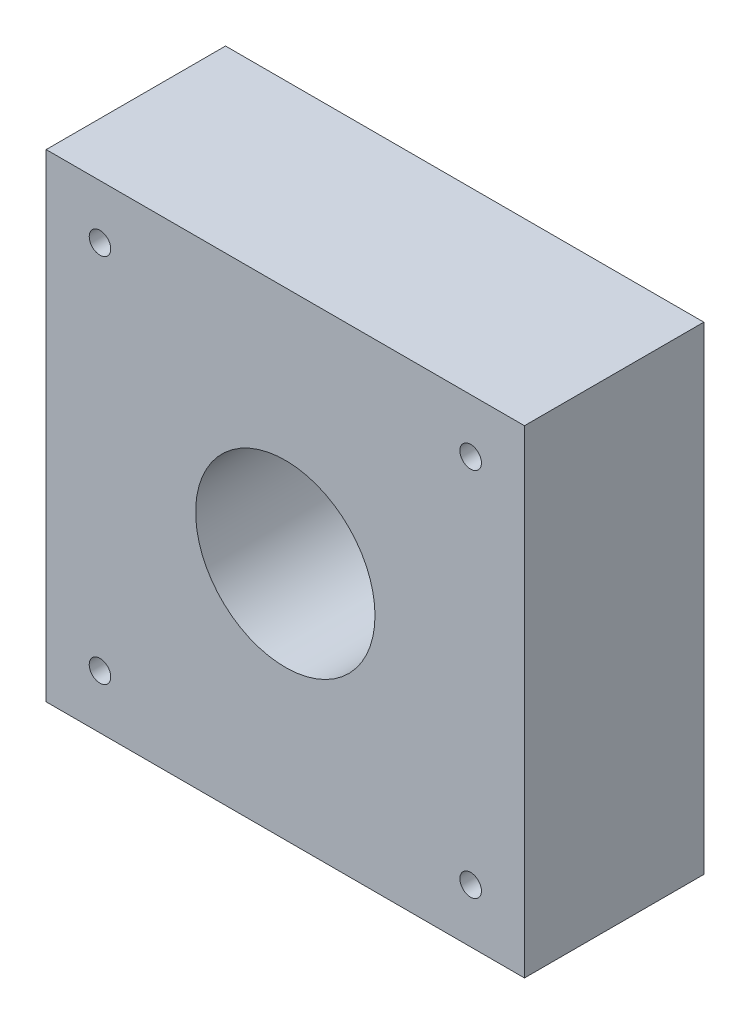
from build123d import *

# Parameters (mm, degrees)
SKIZZE1_W                                            = 40
SKIZZE1_H                                            = 40
AUFSATZ_LINEAR_AUSTRAGEN1_DEPTH                      = 15
SKIZZE3_R                                            = 7.5
SCHNITT_LINEAR_AUSTRAGEN1_DEPTH                      = 12
DURCHGANGSLOCH_F_R_M41_D                             = 4.5
DURCHGANGSLOCH_F_R_M1_61_D                           = 1.8
FORMSENKUNG_F_R_M1_6_SENKSCHRAUBE_MIT_SC_D           = 1.8
FORMSENKUNG_F_R_M1_6_SENKSCHRAUBE_MIT_SC_CSINK_D     = 3.6
FORMSENKUNG_F_R_M1_6_SENKSCHRAUBE_MIT_SC_CSINK_ANGLE = 90


with BuildPart() as part:
    # Skizze1 → Aufsatz-Linear austragen1 (new body)
    with BuildSketch(Plane.XY):
        with Locations((4.479166667, 4.375)):
            Rectangle(SKIZZE1_W, SKIZZE1_H)
    extrude(amount=AUFSATZ_LINEAR_AUSTRAGEN1_DEPTH)

    # Skizze3 → Schnitt-Linear austragen1 (cut)
    with BuildSketch(Plane.XY.offset(15)):
        with Locations((4.479166667, 4.375)):
            Circle(SKIZZE3_R)
    extrude(amount=-SCHNITT_LINEAR_AUSTRAGEN1_DEPTH, mode=Mode.SUBTRACT)

    # Durchgangsloch für M41 (through all)
    with Locations(Plane.XY.offset(3)):
        with Locations((4.479166667, 4.375)):
            Hole(DURCHGANGSLOCH_F_R_M41_D / 2)

    # Durchgangsloch für M1.61 (through all)
    with Locations(Plane.XY.offset(3)):
        with Locations((4.479166667, 8.875), (4.479166667, -0.125)):
            Hole(DURCHGANGSLOCH_F_R_M1_61_D / 2)

    # Formsenkung für M1.6 Senkschraube mit Schlitz/Kreuzschlitz1 (through all)
    with Locations(Plane(origin=(0, 0, 0), x_dir=(-1, 0, 0), z_dir=(0, 0, -1))):
        with Locations((-19.979166667, 19.875), (11.020833333, 19.875), (11.020833333, -11.125), (-19.979166667, -11.125)):
            CounterSinkHole(FORMSENKUNG_F_R_M1_6_SENKSCHRAUBE_MIT_SC_D / 2, FORMSENKUNG_F_R_M1_6_SENKSCHRAUBE_MIT_SC_CSINK_D / 2, counter_sink_angle=FORMSENKUNG_F_R_M1_6_SENKSCHRAUBE_MIT_SC_CSINK_ANGLE)


solid = part.part
